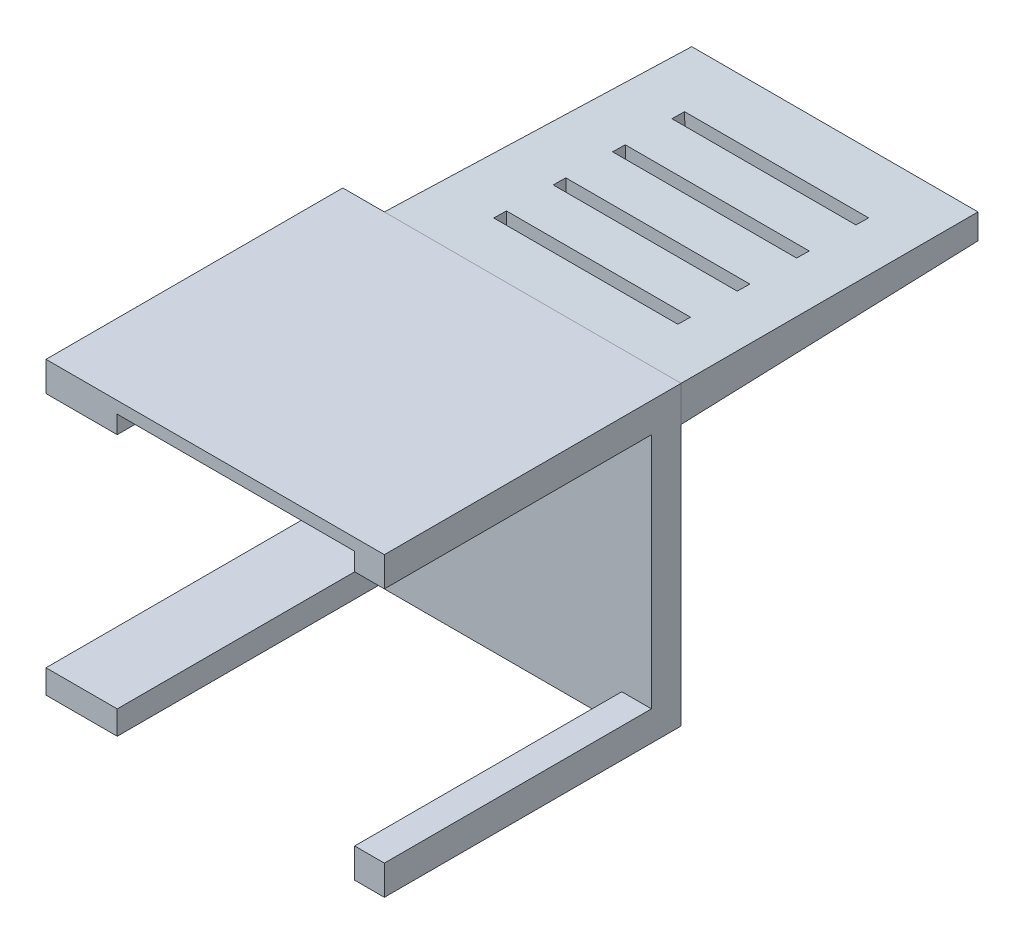
from build123d import *

# Parameters (mm, degrees)
SKETCH1_W           = 500
SKETCH1_H           = 500
BOSS_EXTRUDE1_DEPTH = 50
SKETCH2_W           = 50
SKETCH2_H           = 50
BOSS_EXTRUDE2_DEPTH = 450
SKETCH3_W           = 400
SKETCH3_H           = 20
BOSS_EXTRUDE3_DEPTH = 450
SKETCH4_W           = 500
SKETCH4_H           = 60
BOSS_EXTRUDE4_DEPTH = 509
BOSS_EXTRUDE4_TAPER = 1
SKETCH5_W           = 310
SKETCH5_H           = 21.323695684
CUT_EXTRUDE1_DEPTH  = 509
BOSS_EXTRUDE5_DEPTH = 70
SKETCH7_W           = 120
SKETCH7_H           = 450
CUT_EXTRUDE2_DEPTH  = 10


with BuildPart() as part:
    # Sketch1 → Boss-Extrude1 (new body)
    with BuildSketch(Plane.XY):
        with Locations((-6.756756757, -117.398648649)):
            Rectangle(SKETCH1_W, SKETCH1_H)
    extrude(amount=BOSS_EXTRUDE1_DEPTH)

    # Sketch2 → Boss-Extrude2 (add)
    with BuildSketch(Plane.XY.offset(50)):
        with Locations((-231.756756757, 107.601351351)):
            Rectangle(SKETCH2_W, SKETCH2_H)
        with Locations((218.243243243, 107.601351351)):
            Rectangle(SKETCH2_W, SKETCH2_H)
        with Locations((218.243243243, -342.398648649)):
            Rectangle(SKETCH2_W, SKETCH2_H)
        with Locations((-231.756756757, -342.398648649)):
            Rectangle(SKETCH2_W, SKETCH2_H)
    extrude(amount=BOSS_EXTRUDE2_DEPTH)

    # Sketch3 → Boss-Extrude3 (add)
    with BuildSketch(Plane.XY.offset(50)):
        with Locations((-6.756756757, 122.601351351)):
            Rectangle(SKETCH3_W, SKETCH3_H)
    extrude(amount=BOSS_EXTRUDE3_DEPTH)

    # Sketch4 → Boss-Extrude4 (add)
    with BuildSketch(Plane(origin=(0, 0, 0), x_dir=(-1, 0, 0), z_dir=(0, 0, -1))):
        with Locations((6.756756757, 102.601351351)):
            Rectangle(SKETCH4_W, SKETCH4_H)
    extrude(amount=BOSS_EXTRUDE4_DEPTH, taper=BOSS_EXTRUDE4_TAPER)

    # Sketch5 → Cut-Extrude1 (cut)
    with BuildSketch(Plane(origin=(0, 72.579237961, 1.266875311), x_dir=(1, 0, 0), z_dir=(0, -0.9998476951563913, -0.01745240643728355))):
        with Locations((-2.218768488, -397.78694869)):
            Rectangle(SKETCH5_W, SKETCH5_H)
        with Locations((-2.218768488, -297.78694869)):
            Rectangle(SKETCH5_W, SKETCH5_H)
        with Locations((-2.218768488, -197.78694869)):
            Rectangle(SKETCH5_W, SKETCH5_H)
        with Locations((-2.218768488, -97.78694869)):
            Rectangle(SKETCH5_W, SKETCH5_H)
    extrude(amount=-CUT_EXTRUDE1_DEPTH, mode=Mode.SUBTRACT)

    # Sketch6 → Boss-Extrude5 (add)
    with BuildSketch(Plane.ZY.offset(256.756756757)):
        Polygon((500, 132.601351351), (0, 132.601351351), (0, -367.398648649), (500, -367.398648649), (500, -317.398648649), (50, -317.398648649), (50, 82.601351351), (500, 82.601351351), align=None)
    extrude(amount=BOSS_EXTRUDE5_DEPTH)

    # Sketch7 → Cut-Extrude2 (cut)
    with BuildSketch(Plane.XZ.offset(367.398648649)):
        with Locations((-266.756756757, 275)):
            Rectangle(SKETCH7_W, SKETCH7_H)
    extrude(amount=-CUT_EXTRUDE2_DEPTH, mode=Mode.SUBTRACT)


solid = part.part
